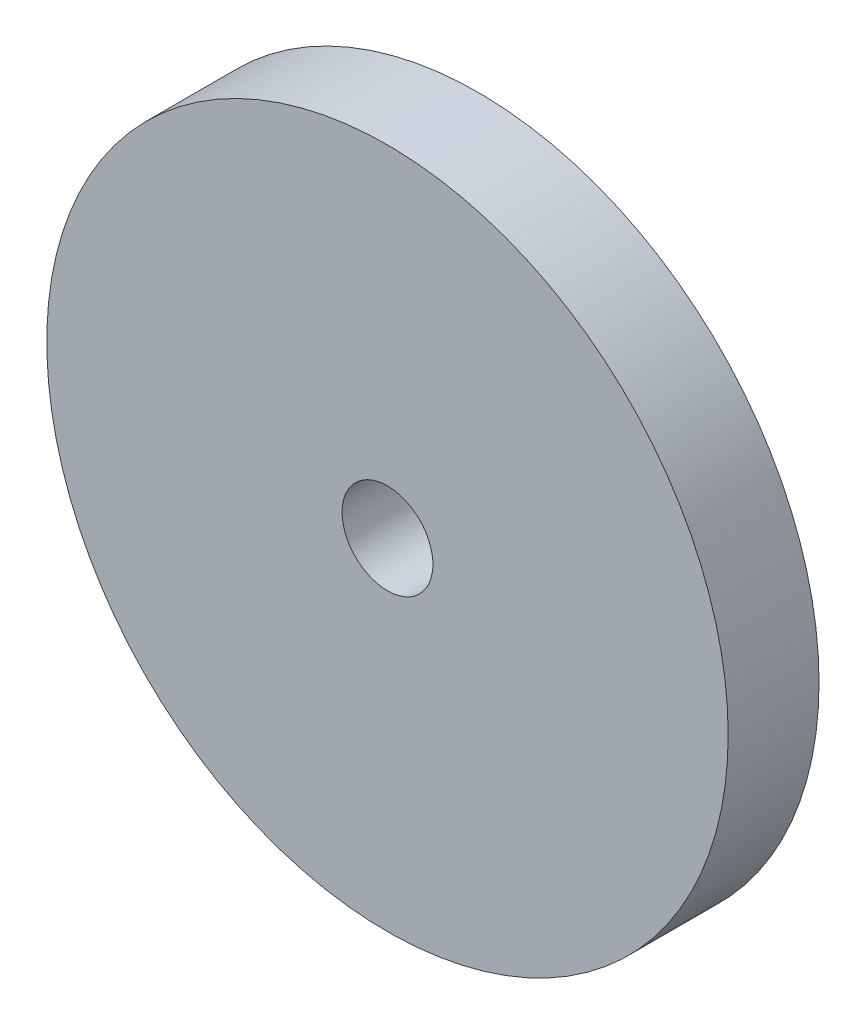
from build123d import *

# Parameters (mm, degrees)
SKETCH_1_R          = 22.5
EXTRUDE_1_DEPTH     = 10
SKETCH_2_R          = 37.5
EXTRUDE_2_DEPTH     = 10
SKETCH_3_R          = 5
CUT_EXTRUDE_1_DEPTH = 20


with BuildPart() as part:
    # 草图1 → 凸台-拉伸1 (new body)
    with BuildSketch(Plane.XY):
        with Locations((-30.640916886, 5.950554874)):
            Circle(SKETCH_1_R)
    extrude(amount=EXTRUDE_1_DEPTH)

    # 草图2 → 凸台-拉伸2 (add)
    with BuildSketch(Plane.XY.offset(10)):
        with Locations((-30.640916886, 5.950554874)):
            Circle(SKETCH_2_R)
    extrude(amount=EXTRUDE_2_DEPTH)

    # 草图3 → 切除-拉伸1 (cut)
    with BuildSketch(Plane(origin=(0, 0, 0), x_dir=(-1, 0, 0), z_dir=(0, 0, -1))):
        with Locations((30.640916886, 5.950554874)):
            Circle(SKETCH_3_R)
    extrude(amount=-CUT_EXTRUDE_1_DEPTH, mode=Mode.SUBTRACT)


solid = part.part
